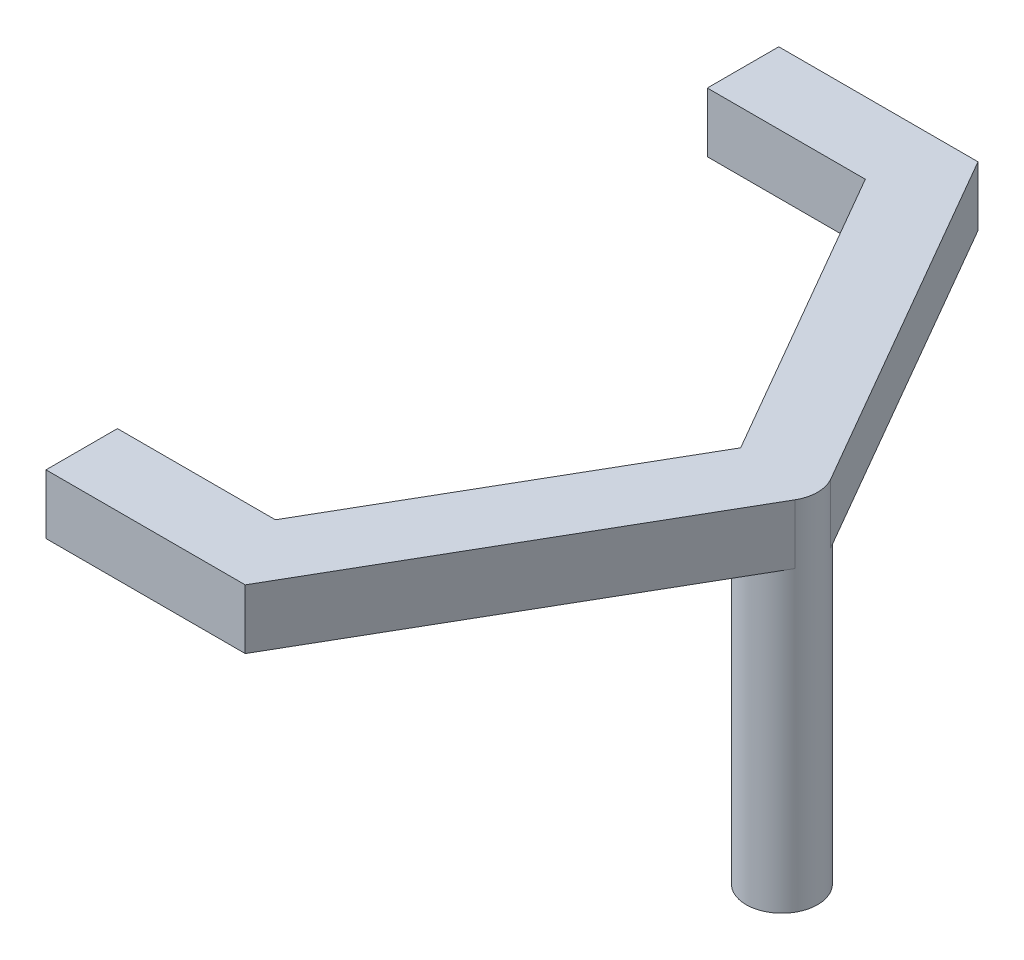
from build123d import *

# Parameters (mm, degrees)
SKETCH1_R             = 3
STEERING_COLUMN_DEPTH = 30
LEFT_HANDLE_BAR_DEPTH = 5


with BuildPart() as part:
    # Sketch1 → Steering Column (new body)
    with BuildSketch(Plane(origin=(0, 0, 0), x_dir=(1, 0, 0), z_dir=(0, 1, 0))):
        with Locations(Location((0, 0, 0), (0, 0, 270))):
            Circle(SKETCH1_R)
    extrude(amount=STEERING_COLUMN_DEPTH)

    # Sketch2 → Left Handle Bar (add)
    with BuildSketch(Plane(origin=(0, 30, 0), x_dir=(1, 0, 0), z_dir=(0, 1, 0))):
        Polygon((2.598076211, 1.5), (-14.300966168, 30.77), (-31.033016975, 30.77), (-31.033016975, 24.77), (-17.765067783, 24.77), (-2.598076211, -1.5), align=None)
    left_handle_bar = extrude(amount=-LEFT_HANDLE_BAR_DEPTH)

    # Mirror1: Left Handle Bar across plane
    add(left_handle_bar.mirror(Plane.XY))


solid = part.part
